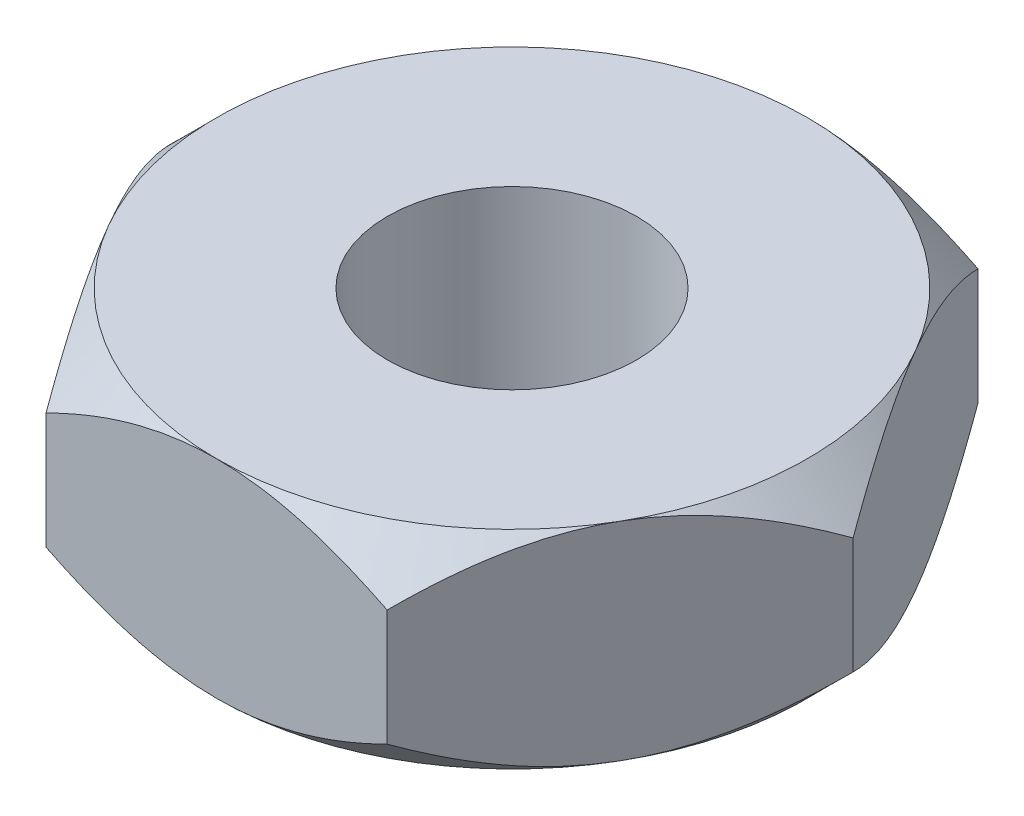
from build123d import *

# Parameters (mm, degrees)
SKETCH_1_R          = 3
EXTRUDE_2_DEPTH     = 2.5
SKETCH_4_OUTSIDE_W  = 48.83
SKETCH_4_OUTSIDE_H  = 46.628
SKETCH_4_OUTSIDE_R  = 7.116873297
CUT_EXTRUDE_1_DEPTH = 12.965912678
CUT_EXTRUDE_1_DRAFT = -45
SKETCH_5_OUTSIDE_W  = 48.83
SKETCH_5_OUTSIDE_H  = 46.628
SKETCH_5_OUTSIDE_R  = 7.116873297
CUT_EXTRUDE_2_DEPTH = 12.965912678
CUT_EXTRUDE_2_DRAFT = -45


with BuildPart() as part:
    # 草图1 → 凸台-拉伸2 (new, symmetric)
    with BuildSketch(Plane(origin=(0, 0, 0), x_dir=(1, 0, 0), z_dir=(0, 1, 0))):
        Polygon((8.217857428, 0), (4.108928714, 7.116873297), (-4.108928714, 7.116873297), (-8.217857428, 0), (-4.108928714, -7.116873297), (4.108928714, -7.116873297), align=None)
        with Locations(Location((0, 0, 0), (0, 0, 270))):
            Circle(SKETCH_1_R, mode=Mode.SUBTRACT)
    extrude(amount=EXTRUDE_2_DEPTH, both=True)


with BuildPart() as cut_extrude_1_tool:
    # 草图4 outside → 切除-拉伸1 (with draft: the straight prism first)
    with BuildSketch(Plane(origin=(0, 2.5, 0), x_dir=(1, 0, 0), z_dir=(0, 1, 0))):
        Rectangle(SKETCH_4_OUTSIDE_W, SKETCH_4_OUTSIDE_H)
        Circle(SKETCH_4_OUTSIDE_R, mode=Mode.SUBTRACT)
    extrude(amount=-CUT_EXTRUDE_1_DEPTH)
    # 切除-拉伸1: the draft: its side faces are tilted about the plane it starts from
    cut_extrude_1_sides = [cut_extrude_1_tool.faces().sort_by_distance(p)[0] for p in [
        (0, -3.982956339, 23.314),
        (24.415, -3.982956339, 0),
        (0, -3.982956339, -23.314),
        (-24.415, -3.982956339, 0),
        (-7.116873297, -3.982956339, 0),
    ]]
    draft(cut_extrude_1_sides, Plane(origin=(0, 2.5, 0), x_dir=(1, 0, 0), z_dir=(0, 1, 0)), CUT_EXTRUDE_1_DRAFT)


with BuildPart() as part_1:
    add(part.part)

    # 切除-拉伸1: cut by cut_extrude_1_tool
    add(cut_extrude_1_tool.part, mode=Mode.SUBTRACT)


with BuildPart() as cut_extrude_2_tool:
    # 草图5 outside → 切除-拉伸2 (with draft: the straight prism first)
    with BuildSketch(Plane.XZ.offset(2.5)):
        Rectangle(SKETCH_5_OUTSIDE_W, SKETCH_5_OUTSIDE_H)
        Circle(SKETCH_5_OUTSIDE_R, mode=Mode.SUBTRACT)
    extrude(amount=-CUT_EXTRUDE_2_DEPTH)
    # 切除-拉伸2: the draft: its side faces are tilted about the plane it starts from
    cut_extrude_2_sides = [cut_extrude_2_tool.faces().sort_by_distance(p)[0] for p in [
        (0, 3.982956339, -23.314),
        (24.415, 3.982956339, 0),
        (0, 3.982956339, 23.314),
        (-24.415, 3.982956339, 0),
        (-7.116873297, 3.982956339, 0),
    ]]
    draft(cut_extrude_2_sides, Plane.XZ.offset(2.5), CUT_EXTRUDE_2_DRAFT)


with BuildPart() as part_2:
    add(part_1.part)

    # 切除-拉伸2: cut by cut_extrude_2_tool
    add(cut_extrude_2_tool.part, mode=Mode.SUBTRACT)


solid = part_2.part
